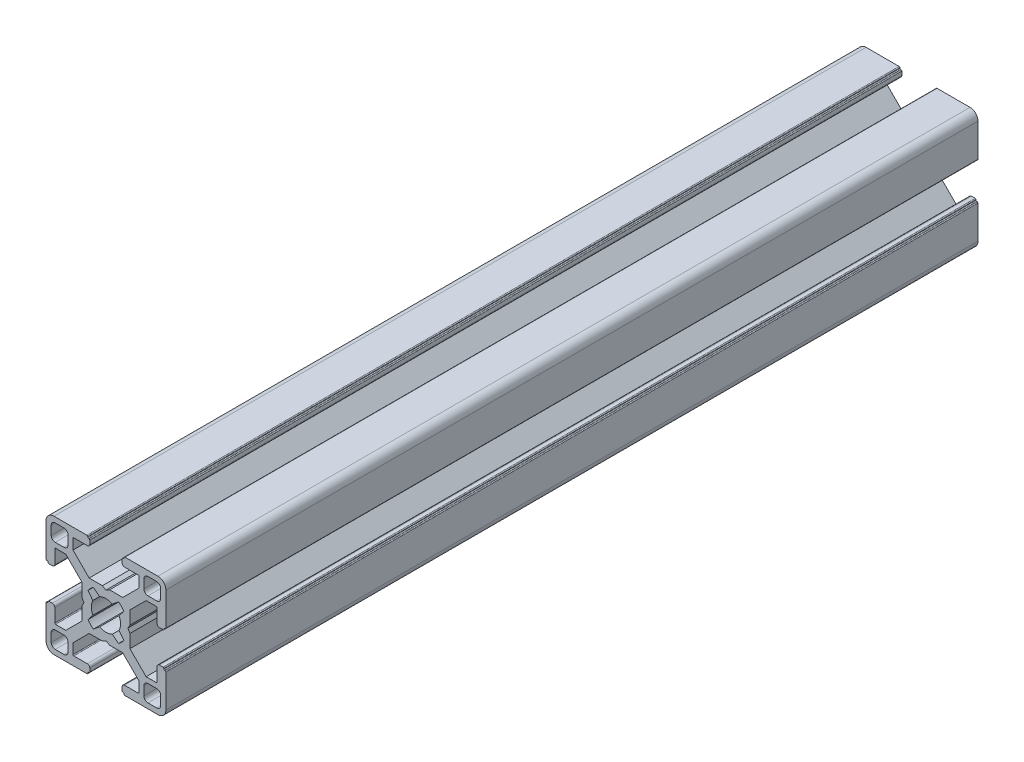
from build123d import *

# Parameters (mm, degrees)
BOSS_EXTRUDE1_DEPTH = 203.2


with BuildPart() as part:
    # Sketch1 → Boss-Extrude1 (new body)
    with BuildSketch(Plane.XY):
        with BuildLine():
            Line((6.00446543, 0.899999619), (5.484852164, 0))
            Line((5.484852164, 0), (6.00446543, -0.899999619))
            Line((6.00446543, -0.899999619), (6.00446543, -4.204465866))
            Line((6.00446543, -4.204465866), (10.049999564, -8.25))
            Line((10.049999564, -8.25), (12.59999928, -8.25))
            ThreePointArc((12.59999928, -8.25), (12.741420837, -8.191421273), (12.799999564, -8.049999716))
            Line((12.799999564, -8.049999716), (12.799999564, -4.649999613))
            ThreePointArc((12.799999564, -4.649999613), (12.975735606, -4.225735278), (13.39999994, -4.049999237))
            Line((13.39999994, -4.049999237), (14.300000043, -4.049999237))
            ThreePointArc((14.300000043, -4.049999237), (14.4414216, -4.108577964), (14.500000327, -4.249999521))
            Line((14.500000327, -4.249999521), (14.500000327, -4.349998953))
            ThreePointArc((14.500000327, -4.349998953), (14.558579054, -4.49142051), (14.700000611, -4.549999237))
            Line((14.700000611, -4.549999237), (14.799999716, -4.549999237))
            ThreePointArc((14.799999716, -4.549999237), (14.941421273, -4.608577964), (15, -4.749999521))
            Line((15, -4.749999521), (15, -13.000000346))
            ThreePointArc((15, -13.000000346), (14.414213664, -14.414213664), (13.000000346, -15))
            Line((13.000000346, -15), (4.749999945, -15))
            ThreePointArc((4.749999945, -15), (4.60857832, -14.941421245), (4.549999564, -14.799999619))
            Line((4.549999564, -14.799999619), (4.549999564, -14.69999942))
            ThreePointArc((4.549999564, -14.69999942), (4.49142109, -14.558578474), (4.350000144, -14.5))
            Line((4.350000144, -14.5), (4.250000374, -14.5))
            ThreePointArc((4.250000374, -14.5), (4.108578753, -14.441421247), (4.05, -14.299999626))
            Line((4.05, -14.299999626), (4.05, -13.399999434))
            ThreePointArc((4.05, -13.399999434), (4.225735989, -12.975735226), (4.650000197, -12.799999237))
            Line((4.650000197, -12.799999237), (8.049999924, -12.799999237))
            ThreePointArc((8.049999924, -12.799999237), (8.191421565, -12.741420475), (8.250000327, -12.599998834))
            Line((8.250000327, -12.599998834), (8.250000327, -10.049999237))
            Line((8.250000327, -10.049999237), (4.204466193, -6))
            Line((4.204466193, -6), (0.899999946, -6))
            Line((0.899999946, -6), (0, -5.484851837))
            Line((0, -5.484851837), (-0.899999946, -6))
            Line((-0.899999946, -6), (-4.204466193, -6))
            Line((-4.204466193, -6), (-8.250000327, -10.049999237))
            Line((-8.250000327, -10.049999237), (-8.250000327, -12.599998834))
            ThreePointArc((-8.250000327, -12.599998834), (-8.191421565, -12.741420475), (-8.049999924, -12.799999237))
            Line((-8.049999924, -12.799999237), (-4.650000197, -12.799999237))
            ThreePointArc((-4.650000197, -12.799999237), (-4.225735989, -12.975735226), (-4.05, -13.399999434))
            Line((-4.05, -13.399999434), (-4.05, -14.299999626))
            ThreePointArc((-4.05, -14.299999626), (-4.108578753, -14.441421247), (-4.250000374, -14.5))
            Line((-4.250000374, -14.5), (-4.350000144, -14.5))
            ThreePointArc((-4.350000144, -14.5), (-4.49142109, -14.558578474), (-4.549999564, -14.69999942))
            Line((-4.549999564, -14.69999942), (-4.549999564, -14.799999619))
            ThreePointArc((-4.549999564, -14.799999619), (-4.60857832, -14.941421245), (-4.749999945, -15))
            Line((-4.749999945, -15), (-13.000000346, -15))
            ThreePointArc((-13.000000346, -15), (-14.414213664, -14.414213664), (-15, -13.000000346))
            Line((-15, -13.000000346), (-15, -4.749999521))
            ThreePointArc((-15, -4.749999521), (-14.941421273, -4.608577964), (-14.799999716, -4.549999237))
            Line((-14.799999716, -4.549999237), (-14.700000611, -4.549999237))
            ThreePointArc((-14.700000611, -4.549999237), (-14.558579054, -4.49142051), (-14.500000327, -4.349998953))
            Line((-14.500000327, -4.349998953), (-14.500000327, -4.249999521))
            ThreePointArc((-14.500000327, -4.249999521), (-14.4414216, -4.108577964), (-14.300000043, -4.049999237))
            Line((-14.300000043, -4.049999237), (-13.39999994, -4.049999237))
            ThreePointArc((-13.39999994, -4.049999237), (-12.975735606, -4.225735278), (-12.799999564, -4.649999613))
            Line((-12.799999564, -4.649999613), (-12.799999564, -8.049999716))
            ThreePointArc((-12.799999564, -8.049999716), (-12.741420837, -8.191421273), (-12.59999928, -8.25))
            Line((-12.59999928, -8.25), (-10.049999564, -8.25))
            Line((-10.049999564, -8.25), (-6.00446543, -4.204465866))
            Line((-6.00446543, -4.204465866), (-6.00446543, -0.899999619))
            Line((-6.00446543, -0.899999619), (-5.484852164, 0))
            Line((-5.484852164, 0), (-6.00446543, 0.899999619))
            Line((-6.00446543, 0.899999619), (-6.00446543, 4.204465866))
            Line((-6.00446543, 4.204465866), (-10.049999564, 8.25))
            Line((-10.049999564, 8.25), (-12.59999928, 8.25))
            ThreePointArc((-12.59999928, 8.25), (-12.741420837, 8.191421273), (-12.799999564, 8.049999716))
            Line((-12.799999564, 8.049999716), (-12.799999564, 4.649999613))
            ThreePointArc((-12.799999564, 4.649999613), (-12.975735606, 4.225735278), (-13.39999994, 4.049999237))
            Line((-13.39999994, 4.049999237), (-14.300000043, 4.049999237))
            ThreePointArc((-14.300000043, 4.049999237), (-14.4414216, 4.108577964), (-14.500000327, 4.249999521))
            Line((-14.500000327, 4.249999521), (-14.500000327, 4.349998953))
            ThreePointArc((-14.500000327, 4.349998953), (-14.558579054, 4.49142051), (-14.700000611, 4.549999237))
            Line((-14.700000611, 4.549999237), (-14.799999716, 4.549999237))
            ThreePointArc((-14.799999716, 4.549999237), (-14.941421273, 4.608577964), (-15, 4.749999521))
            Line((-15, 4.749999521), (-15, 13.000000346))
            ThreePointArc((-15, 13.000000346), (-14.414213664, 14.414213664), (-13.000000346, 15))
            Line((-13.000000346, 15), (-4.749999945, 15))
            ThreePointArc((-4.749999945, 15), (-4.60857832, 14.941421245), (-4.549999564, 14.799999619))
            Line((-4.549999564, 14.799999619), (-4.549999564, 14.69999942))
            ThreePointArc((-4.549999564, 14.69999942), (-4.49142109, 14.558578474), (-4.350000144, 14.5))
            Line((-4.350000144, 14.5), (-4.250000374, 14.5))
            ThreePointArc((-4.250000374, 14.5), (-4.108578753, 14.441421247), (-4.05, 14.299999626))
            Line((-4.05, 14.299999626), (-4.05, 13.399999434))
            ThreePointArc((-4.05, 13.399999434), (-4.225735989, 12.975735226), (-4.650000197, 12.799999237))
            Line((-4.650000197, 12.799999237), (-8.049999924, 12.799999237))
            ThreePointArc((-8.049999924, 12.799999237), (-8.191421565, 12.741420475), (-8.250000327, 12.599998834))
            Line((-8.250000327, 12.599998834), (-8.250000327, 10.049999237))
            Line((-8.250000327, 10.049999237), (-4.204466193, 6))
            Line((-4.204466193, 6), (-0.899999946, 6))
            Line((-0.899999946, 6), (0, 5.484851837))
            Line((0, 5.484851837), (0.899999946, 6))
            Line((0.899999946, 6), (4.204466193, 6))
            Line((4.204466193, 6), (8.250000327, 10.049999237))
            Line((8.250000327, 10.049999237), (8.250000327, 12.599998834))
            ThreePointArc((8.250000327, 12.599998834), (8.191421565, 12.741420475), (8.049999924, 12.799999237))
            Line((8.049999924, 12.799999237), (4.650000197, 12.799999237))
            ThreePointArc((4.650000197, 12.799999237), (4.225735989, 12.975735226), (4.05, 13.399999434))
            Line((4.05, 13.399999434), (4.05, 14.299999626))
            ThreePointArc((4.05, 14.299999626), (4.108578753, 14.441421247), (4.250000374, 14.5))
            Line((4.250000374, 14.5), (4.350000144, 14.5))
            ThreePointArc((4.350000144, 14.5), (4.49142109, 14.558578474), (4.549999564, 14.69999942))
            Line((4.549999564, 14.69999942), (4.549999564, 14.799999619))
            ThreePointArc((4.549999564, 14.799999619), (4.60857832, 14.941421245), (4.749999945, 15))
            Line((4.749999945, 15), (13.000000346, 15))
            ThreePointArc((13.000000346, 15), (14.414213664, 14.414213664), (15, 13.000000346))
            Line((15, 13.000000346), (15, 4.749999521))
            ThreePointArc((15, 4.749999521), (14.941421273, 4.608577964), (14.799999716, 4.549999237))
            Line((14.799999716, 4.549999237), (14.700000611, 4.549999237))
            ThreePointArc((14.700000611, 4.549999237), (14.558579054, 4.49142051), (14.500000327, 4.349998953))
            Line((14.500000327, 4.349998953), (14.500000327, 4.249999521))
            ThreePointArc((14.500000327, 4.249999521), (14.4414216, 4.108577964), (14.300000043, 4.049999237))
            Line((14.300000043, 4.049999237), (13.39999994, 4.049999237))
            ThreePointArc((13.39999994, 4.049999237), (12.975735606, 4.225735278), (12.799999564, 4.649999613))
            Line((12.799999564, 4.649999613), (12.799999564, 8.049999716))
            ThreePointArc((12.799999564, 8.049999716), (12.741420837, 8.191421273), (12.59999928, 8.25))
            Line((12.59999928, 8.25), (10.049999564, 8.25))
            Line((10.049999564, 8.25), (6.00446543, 4.204465866))
            Line((6.00446543, 4.204465866), (6.00446543, 0.899999619))
        make_face()
        with BuildLine():
            Line((13.70000109, 12.700000398), (13.70000109, 10.499999635))
            ThreePointArc((13.70000109, 10.499999635), (13.407107874, 9.792892851), (12.70000109, 9.499999635))
            Line((12.70000109, 9.499999635), (10.500000327, 9.499999635))
            ThreePointArc((10.500000327, 9.499999635), (9.792893543, 9.792892851), (9.500000327, 10.499999635))
            Line((9.500000327, 10.499999635), (9.500000327, 12.700000398))
            ThreePointArc((9.500000327, 12.700000398), (9.792893543, 13.407107182), (10.500000327, 13.700000398))
            Line((10.500000327, 13.700000398), (12.70000109, 13.700000398))
            ThreePointArc((12.70000109, 13.700000398), (13.407107874, 13.407107182), (13.70000109, 12.700000398))
        make_face(mode=Mode.SUBTRACT)
        with BuildLine():
            Line((3.135929412, 4.518400903), (1.600129524, 3.280561767))
            ThreePointArc((1.600129524, 3.280561767), (0, 3.65), (-1.600129524, 3.280561767))
            Line((-1.600129524, 3.280561767), (-3.135929412, 4.518400903))
            ThreePointArc((-3.135929412, 4.518400903), (-3.881002259, 3.897155561), (-4.505336892, 3.154669473))
            Line((-4.505336892, 3.154669473), (-3.280561732, 1.600129597))
            ThreePointArc((-3.280561732, 1.600129597), (-3.65, 0), (-3.280561732, -1.600129597))
            Line((-3.280561732, -1.600129597), (-4.505336892, -3.154669473))
            ThreePointArc((-4.505336892, -3.154669473), (-3.881002259, -3.897155561), (-3.135929412, -4.518400903))
            Line((-3.135929412, -4.518400903), (-1.600129524, -3.280561767))
            ThreePointArc((-1.600129524, -3.280561767), (0, -3.65), (1.600129524, -3.280561767))
            Line((1.600129524, -3.280561767), (3.135929412, -4.518400903))
            ThreePointArc((3.135929412, -4.518400903), (3.881002259, -3.897155561), (4.505336892, -3.154669473))
            Line((4.505336892, -3.154669473), (3.280561732, -1.600129597))
            ThreePointArc((3.280561732, -1.600129597), (3.65, 0), (3.280561732, 1.600129597))
            Line((3.280561732, 1.600129597), (4.505336892, 3.154669473))
            ThreePointArc((4.505336892, 3.154669473), (3.881002259, 3.897155561), (3.135929412, 4.518400903))
        make_face(mode=Mode.SUBTRACT)
        with BuildLine():
            Line((-13.70000109, -12.700000398), (-13.70000109, -10.499999635))
            ThreePointArc((-13.70000109, -10.499999635), (-13.407107874, -9.792892851), (-12.70000109, -9.499999635))
            Line((-12.70000109, -9.499999635), (-10.500000327, -9.499999635))
            ThreePointArc((-10.500000327, -9.499999635), (-9.792893543, -9.792892851), (-9.500000327, -10.499999635))
            Line((-9.500000327, -10.499999635), (-9.500000327, -12.700000398))
            ThreePointArc((-9.500000327, -12.700000398), (-9.792893543, -13.407107182), (-10.500000327, -13.700000398))
            Line((-10.500000327, -13.700000398), (-12.70000109, -13.700000398))
            ThreePointArc((-12.70000109, -13.700000398), (-13.407107874, -13.407107182), (-13.70000109, -12.700000398))
        make_face(mode=Mode.SUBTRACT)
        with BuildLine():
            Line((10.500000327, -13.700000398), (12.70000109, -13.700000398))
            ThreePointArc((12.70000109, -13.700000398), (13.407107874, -13.407107182), (13.70000109, -12.700000398))
            Line((13.70000109, -12.700000398), (13.70000109, -10.499999635))
            ThreePointArc((13.70000109, -10.499999635), (13.407107874, -9.792892851), (12.70000109, -9.499999635))
            Line((12.70000109, -9.499999635), (10.500000327, -9.499999635))
            ThreePointArc((10.500000327, -9.499999635), (9.792893543, -9.792892851), (9.500000327, -10.499999635))
            Line((9.500000327, -10.499999635), (9.500000327, -12.700000398))
            ThreePointArc((9.500000327, -12.700000398), (9.792893543, -13.407107182), (10.500000327, -13.700000398))
        make_face(mode=Mode.SUBTRACT)
        with BuildLine():
            Line((-10.500000327, 13.700000398), (-12.70000109, 13.700000398))
            ThreePointArc((-12.70000109, 13.700000398), (-13.407107874, 13.407107182), (-13.70000109, 12.700000398))
            Line((-13.70000109, 12.700000398), (-13.70000109, 10.499999635))
            ThreePointArc((-13.70000109, 10.499999635), (-13.407107874, 9.792892851), (-12.70000109, 9.499999635))
            Line((-12.70000109, 9.499999635), (-10.500000327, 9.499999635))
            ThreePointArc((-10.500000327, 9.499999635), (-9.792893543, 9.792892851), (-9.500000327, 10.499999635))
            Line((-9.500000327, 10.499999635), (-9.500000327, 12.700000398))
            ThreePointArc((-9.500000327, 12.700000398), (-9.792893543, 13.407107182), (-10.500000327, 13.700000398))
        make_face(mode=Mode.SUBTRACT)
    extrude(amount=BOSS_EXTRUDE1_DEPTH)


solid = part.part
